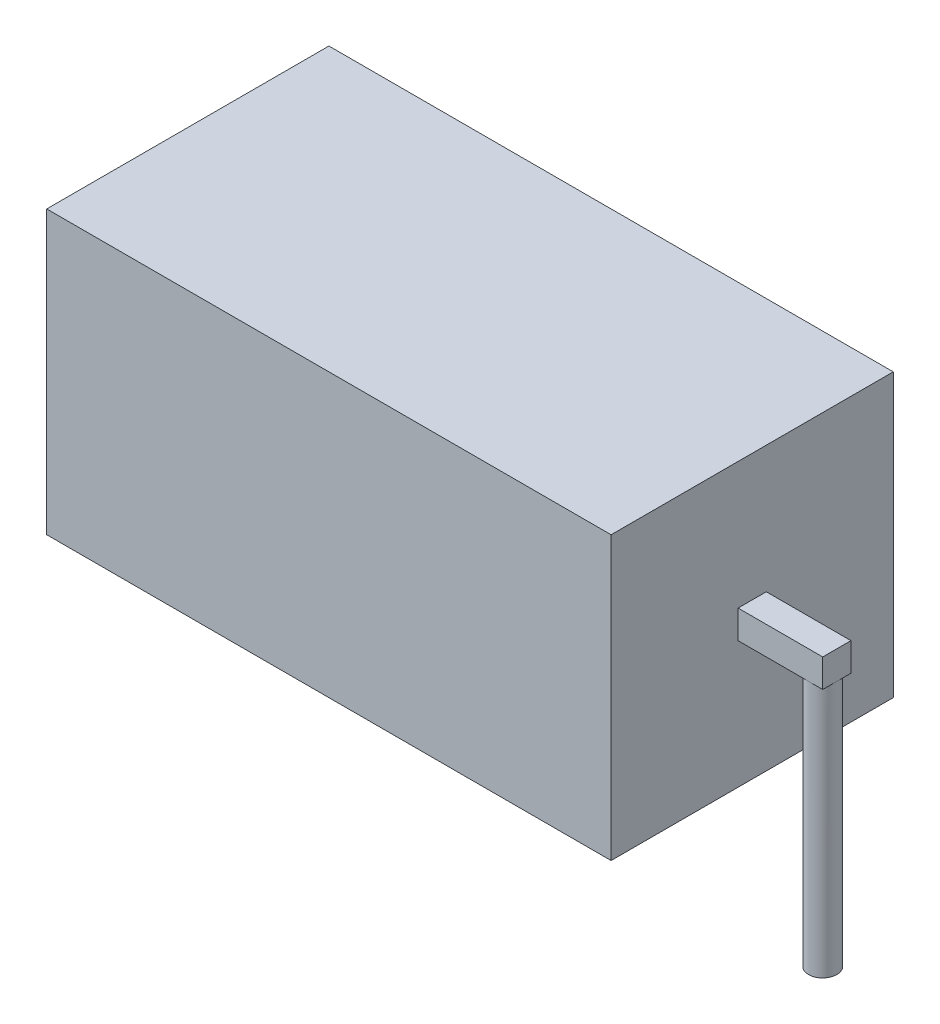
from build123d import *

# Parameters (mm, degrees)
SKETCH_1_W           = 20
SKETCH_1_H           = 10
EXTRUDE_1_DEPTH      = 10
EXTRUDE_2_DEPTH      = 3
EXTRUDE_2_DEPTH_BACK = 23
SKETCH_2_W           = 1
SKETCH_2_H           = 1
SKETCH_3_R           = 0.5
EXTRUDE_3_DEPTH      = 9


with BuildPart() as part:
    # Эскиз1 → Вытянуть1 (new body)
    with BuildSketch(Plane.XY):
        with Locations((10, 5)):
            Rectangle(SKETCH_1_W, SKETCH_1_H)
    extrude(amount=EXTRUDE_1_DEPTH)

    # Эскиз2 → Вытянуть2 (add, two sides: drawn at the far end of the back side and taken through both)
    with BuildSketch(Plane(origin=(20, 0, 0), x_dir=(0, 0, -1), z_dir=(1, 0, 0)).offset(-EXTRUDE_2_DEPTH_BACK)):
        with Locations((-5, 5)):
            Rectangle(SKETCH_2_W, SKETCH_2_H)
    extrude(amount=EXTRUDE_2_DEPTH + EXTRUDE_2_DEPTH_BACK)

    # Эскиз3 → Вытянуть3 (add)
    with BuildSketch(Plane.XZ.offset(-4.5)):
        with Locations((-2.5, 5)):
            Circle(SKETCH_3_R)
        with Locations((22.5, 5)):
            Circle(SKETCH_3_R)
    extrude(amount=EXTRUDE_3_DEPTH)


solid = part.part
